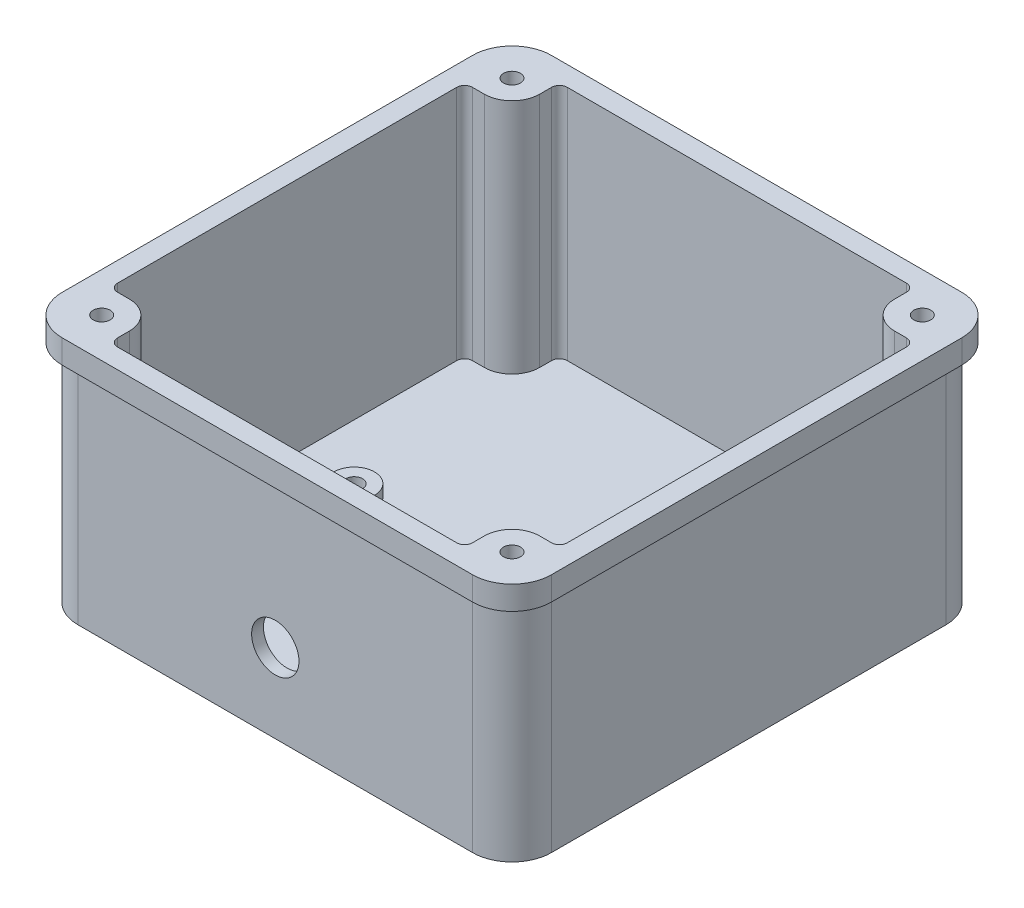
from build123d import *

# Parameters (mm, degrees)
SKETCH1_W           = 120
SKETCH1_H           = 120
BOSS_EXTRUDE1_DEPTH = 63
SHELL1_T            = -3
SKETCH2_R           = 2.15
BOSS_EXTRUDE2_DEPTH = 60
SKETCH3_W           = 124
SKETCH3_H           = 124
SKETCH3_W_2         = 120
SKETCH3_H_2         = 120
BOSS_EXTRUDE3_DEPTH = 6
FILLET1_R           = 10
SKETCH4_R           = 2.15
CUT_EXTRUDE1_DEPTH  = 3
BOSS_EXTRUDE4_START = 3
SKETCH5_R           = 5.15
SKETCH5_R_2         = 2.15
BOSS_EXTRUDE4_DEPTH = 3
SKETCH6_R           = 6
CUT_EXTRUDE2_DEPTH  = 10


with BuildPart() as part:
    # Sketch1 → Boss-Extrude1 (new body)
    with BuildSketch(Plane(origin=(0, 0, 0), x_dir=(1, 0, 0), z_dir=(0, 1, 0))):
        Rectangle(SKETCH1_W, SKETCH1_H)
    extrude(amount=BOSS_EXTRUDE1_DEPTH)

    # Shell1
    shell1_openings = [part.faces().sort_by_distance(p)[0] for p in [
        (0, 63, 0),
    ]]
    offset(amount=SHELL1_T, openings=shell1_openings, kind=Kind.INTERSECTION)

    # Sketch2 → Boss-Extrude2 (add)
    # profile 1 of 4: a face of its own
    with BuildSketch(Plane(origin=(0, 3, 0), x_dir=(1, 0, 0), z_dir=(0, 1, 0))):
        with BuildLine():
            Line((52, 44.98), (55, 44.98))
            ThreePointArc((55, 44.98), (56.414213562, 44.394213562), (57, 42.98))
            Line((57, 42.98), (57, 57))
            Line((57, 57), (42.98, 57))
            ThreePointArc((42.98, 57), (44.394213562, 56.414213562), (44.98, 55))
            Line((44.98, 55), (44.98, 52))
            ThreePointArc((44.98, 52), (47.036110396, 47.036110396), (52, 44.98))
        make_face()
        with Locations((52, 52)):
            Circle(SKETCH2_R, mode=Mode.SUBTRACT)
    # profile 2 of 4: a face of its own
    with BuildSketch(Plane(origin=(0, 3, 0), x_dir=(1, 0, 0), z_dir=(0, 1, 0))):
        with BuildLine():
            Line((-44.98, 52), (-44.98, 55))
            ThreePointArc((-44.98, 55), (-44.394213562, 56.414213562), (-42.98, 57))
            Line((-42.98, 57), (-57, 57))
            Line((-57, 57), (-57, 42.98))
            ThreePointArc((-57, 42.98), (-56.414213562, 44.394213562), (-55, 44.98))
            Line((-55, 44.98), (-52, 44.98))
            ThreePointArc((-52, 44.98), (-47.036110396, 47.036110396), (-44.98, 52))
        make_face()
        with Locations((-52, 52)):
            Circle(SKETCH2_R, mode=Mode.SUBTRACT)
    # profile 3 of 4: a face of its own
    with BuildSketch(Plane(origin=(0, 3, 0), x_dir=(1, 0, 0), z_dir=(0, 1, 0))):
        with BuildLine():
            Line((57, -42.98), (57, -57))
            Line((57, -57), (42.98, -57))
            ThreePointArc((42.98, -57), (44.394213562, -56.414213562), (44.98, -55))
            Line((44.98, -55), (44.98, -52))
            ThreePointArc((44.98, -52), (47.036110396, -47.036110396), (52, -44.98))
            Line((52, -44.98), (55, -44.98))
            ThreePointArc((55, -44.98), (56.414213562, -44.394213562), (57, -42.98))
        make_face()
        with Locations((52, -52)):
            Circle(SKETCH2_R, mode=Mode.SUBTRACT)
    # profile 4 of 4: a face of its own
    with BuildSketch(Plane(origin=(0, 3, 0), x_dir=(1, 0, 0), z_dir=(0, 1, 0))):
        with BuildLine():
            Line((-52, -44.98), (-55, -44.98))
            ThreePointArc((-55, -44.98), (-56.414213562, -44.394213562), (-57, -42.98))
            Line((-57, -42.98), (-57, -57))
            Line((-57, -57), (-42.98, -57))
            ThreePointArc((-42.98, -57), (-44.394213562, -56.414213562), (-44.98, -55))
            Line((-44.98, -55), (-44.98, -52))
            ThreePointArc((-44.98, -52), (-47.036110396, -47.036110396), (-52, -44.98))
        make_face()
        with Locations((-52, -52)):
            Circle(SKETCH2_R, mode=Mode.SUBTRACT)
    extrude(amount=BOSS_EXTRUDE2_DEPTH)

    # Sketch3 → Boss-Extrude3 (add)
    with BuildSketch(Plane(origin=(0, 63, 0), x_dir=(1, 0, 0), z_dir=(0, 1, 0))):
        Rectangle(SKETCH3_W, SKETCH3_H)
        Rectangle(SKETCH3_W_2, SKETCH3_H_2, mode=Mode.SUBTRACT)
    extrude(amount=-BOSS_EXTRUDE3_DEPTH)

    # Fillet1
    fillet1_edges = [part.edges().sort_by_distance(p)[0] for p in [
        (62, 60, 62),
        (60, 28.5, 60),
        (62, 60, -62),
        (60, 28.5, -60),
        (-62, 60, -62),
        (-60, 28.5, -60),
        (-62, 60, 62),
        (-60, 28.5, 60),
    ]]
    fillet(fillet1_edges, radius=FILLET1_R)

    # Sketch4 → Cut-Extrude1 (cut)
    with BuildSketch(Plane(origin=(0, 3, 0), x_dir=(1, 0, 0), z_dir=(0, 1, 0))):
        with Locations((-40, 0)):
            Circle(SKETCH4_R)
        with Locations((40, 0)):
            Circle(SKETCH4_R)
    extrude(amount=-CUT_EXTRUDE1_DEPTH, mode=Mode.SUBTRACT)

    # Sketch5 → Boss-Extrude4 (add)
    # profile 1 of 2: a face of its own
    with BuildSketch(Plane(origin=(0, 3, 0), x_dir=(1, 0, 0), z_dir=(0, 1, 0)).offset(BOSS_EXTRUDE4_START)):
        with Locations((-40, 0)):
            Circle(SKETCH5_R)
        with Locations((-40, 0)):
            Circle(SKETCH5_R_2, mode=Mode.SUBTRACT)
    # profile 2 of 2: a face of its own
    with BuildSketch(Plane(origin=(0, 3, 0), x_dir=(1, 0, 0), z_dir=(0, 1, 0)).offset(BOSS_EXTRUDE4_START)):
        with Locations((40, 0)):
            Circle(SKETCH5_R)
        with Locations((40, 0)):
            Circle(SKETCH5_R_2, mode=Mode.SUBTRACT)
    extrude(amount=-BOSS_EXTRUDE4_DEPTH)

    # Sketch6 → Cut-Extrude2 (cut)
    with BuildSketch(Plane.XY.offset(60)):
        with Locations((0, 20)):
            Circle(SKETCH6_R)
    extrude(amount=-CUT_EXTRUDE2_DEPTH, mode=Mode.SUBTRACT)


solid = part.part
